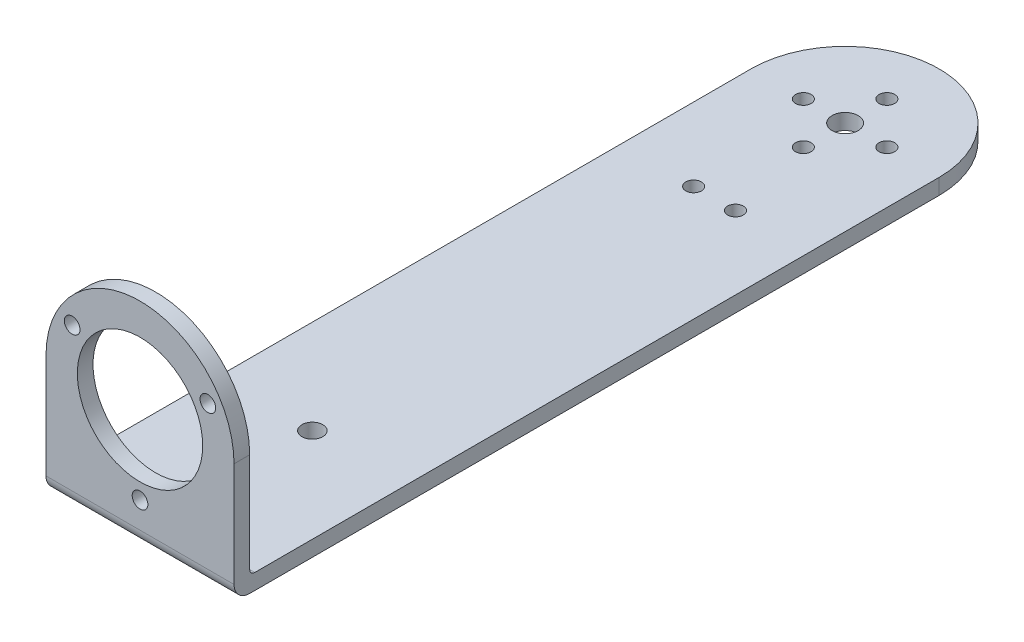
from build123d import *

# Parameters (mm, degrees)
SKETCH_1_R          = 1.5
SKETCH_1_R_2        = 2.5
SKETCH_1_R_3        = 2
EXTRUDE_1_DEPTH     = 3
SKETCH_2_W          = 36
SKETCH_2_H          = 3
EXTRUDE_2_DEPTH     = 41
CUT_EXTRUDE_1_DEPTH = 4
SKETCH_5_R          = 1.5
SKETCH_5_R_2        = 12
CUT_EXTRUDE_2_DEPTH = 4
FILLET_1_R          = 3
FILLET_2_R          = 1


with BuildPart() as part:
    # 草图1 → 凸台-拉伸1 (new body)
    with BuildSketch(Plane(origin=(0, 0, 0), x_dir=(1, 0, 0), z_dir=(0, 1, 0))):
        with BuildLine():
            Line((18, -67.5), (-18, -67.5))
            Line((-18, -67.5), (-18, 67.5))
            ThreePointArc((-18, 67.5), (0, 85.5), (18, 67.5))
            Line((18, 67.5), (18, -67.5))
        make_face()
        with Locations(Location((0, 75.5, 0), (0, 0, 270))):
            Circle(SKETCH_1_R, mode=Mode.SUBTRACT)
        with Locations(Location((0, 59.5, 0), (0, 0, 270))):
            Circle(SKETCH_1_R, mode=Mode.SUBTRACT)
        with Locations(Location((-8, 67.5, 0), (0, 0, 270))):
            Circle(SKETCH_1_R, mode=Mode.SUBTRACT)
        with Locations(Location((8, 67.5, 0), (0, 0, 270))):
            Circle(SKETCH_1_R, mode=Mode.SUBTRACT)
        with Locations(Location((0, 67.5, 0), (0, 0, 270))):
            Circle(SKETCH_1_R_2, mode=Mode.SUBTRACT)
        with Locations(Location((-4, 42.5, 0), (0, 0, 270))):
            Circle(SKETCH_1_R, mode=Mode.SUBTRACT)
        with Locations(Location((4, 42.5, 0), (0, 0, 270))):
            Circle(SKETCH_1_R, mode=Mode.SUBTRACT)
        with Locations(Location((0, -34.5, 0), (0, 0, 270))):
            Circle(SKETCH_1_R_3, mode=Mode.SUBTRACT)
    extrude(amount=EXTRUDE_1_DEPTH)

    # 草图2 → 凸台-拉伸2 (add)
    with BuildSketch(Plane(origin=(0, 3, 0), x_dir=(1, 0, 0), z_dir=(0, 1, 0))):
        with Locations((0, -66)):
            Rectangle(SKETCH_2_W, SKETCH_2_H)
    extrude(amount=EXTRUDE_2_DEPTH)

    # 草图3 → 切除-拉伸1 (cut)
    with BuildSketch(Plane.XY.offset(67.5)):
        with BuildLine():
            Line((-18, 44), (-18, 23))
            ThreePointArc((-18, 23), (0, 41), (18, 23))
            Line((18, 23), (18, 44))
            Line((18, 44), (-18, 44))
        make_face()
    extrude(amount=-CUT_EXTRUDE_1_DEPTH, mode=Mode.SUBTRACT)

    # 草图5 → 切除-拉伸2 (cut)
    with BuildSketch(Plane.XY.offset(67.5)):
        with Locations((0, 8)):
            Circle(SKETCH_5_R)
        with Locations((-12.990381057, 30.5)):
            Circle(SKETCH_5_R)
        with Locations((12.990381057, 30.5)):
            Circle(SKETCH_5_R)
        with Locations((0, 23)):
            Circle(SKETCH_5_R_2)
    extrude(amount=-CUT_EXTRUDE_2_DEPTH, mode=Mode.SUBTRACT)

    # 圆角1
    fillet_1_edges = [part.edges().sort_by_distance(p)[0] for p in [
        (0, 0, 67.5),
    ]]
    fillet(fillet_1_edges, radius=FILLET_1_R)

    # 圆角2
    fillet_2_edges = [part.edges().sort_by_distance(p)[0] for p in [
        (0, 3, 64.5),
    ]]
    fillet(fillet_2_edges, radius=FILLET_2_R)


solid = part.part
